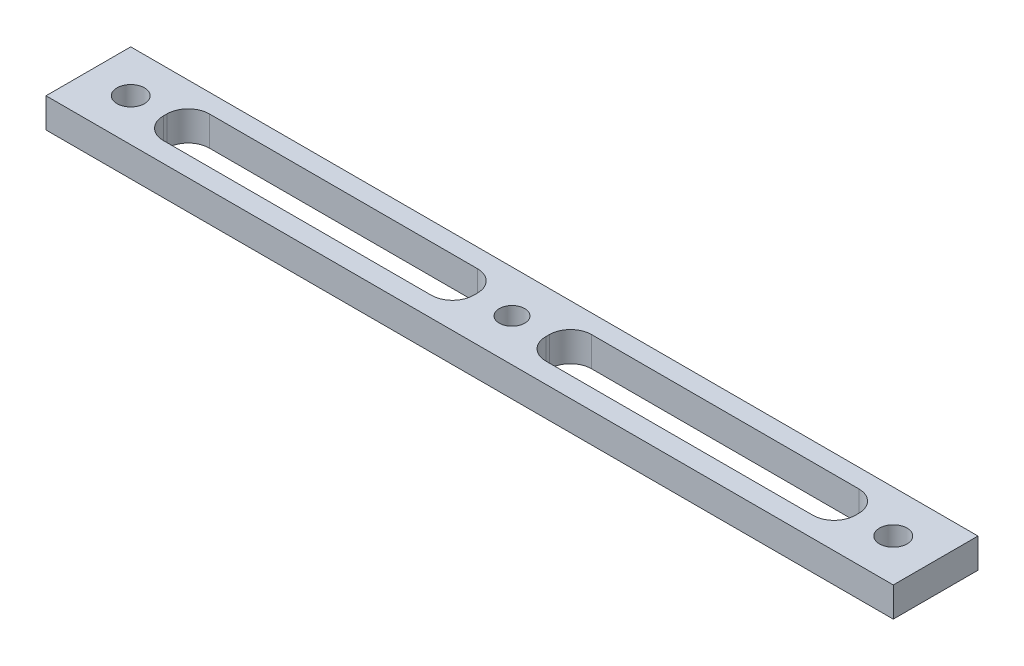
from build123d import *

# Parameters (mm, degrees)
SZKIC1_W                    = 200
SZKIC1_H                    = 20
SZKIC1_R                    = 3
SZKIC1_R_2                  = 3.25
DODANIE_WYCI_GNI_CIE1_DEPTH = 7


with BuildPart() as part:
    # Szkic1 → Dodanie-wyciągnięcie1 (new body)
    with BuildSketch(Plane(origin=(0, 0, 0), x_dir=(1, 0, 0), z_dir=(0, 1, 0))):
        with Locations((100, 10)):
            Rectangle(SZKIC1_W, SZKIC1_H)
        with Locations(Location((100, 10, 0), (0, 0, 270))):
            Circle(SZKIC1_R, mode=Mode.SUBTRACT)
        with Locations(Location((10, 10, 0), (0, 0, 270))):
            Circle(SZKIC1_R_2, mode=Mode.SUBTRACT)
        with Locations(Location((190, 10, 0), (0, 0, 270))):
            Circle(SZKIC1_R_2, mode=Mode.SUBTRACT)
        with BuildLine():
            Line((22.984822323, 15.57457628), (86.25939238, 15.57457628))
            ThreePointArc((86.25939238, 15.57457628), (89.794926286, 14.110110186), (91.25939238, 10.57457628))
            Line((91.25939238, 10.57457628), (91.25939238, 9.696719379))
            ThreePointArc((91.25939238, 9.696719379), (89.794926286, 6.161185473), (86.25939238, 4.696719379))
            Line((86.25939238, 4.696719379), (22.984822323, 4.696719379))
            ThreePointArc((22.984822323, 4.696719379), (19.449288417, 6.161185473), (17.984822323, 9.696719379))
            Line((17.984822323, 9.696719379), (17.984822323, 10.57457628))
            ThreePointArc((17.984822323, 10.57457628), (19.449288417, 14.110110186), (22.984822323, 15.57457628))
        make_face(mode=Mode.SUBTRACT)
        with BuildLine():
            Line((113.225148066, 15.57457628), (176.286209663, 15.57457628))
            ThreePointArc((176.286209663, 15.57457628), (179.821743569, 14.110110186), (181.286209663, 10.57457628))
            Line((181.286209663, 10.57457628), (181.286209663, 9.752776346))
            ThreePointArc((181.286209663, 9.752776346), (179.821743569, 6.21724244), (176.286209663, 4.752776346))
            Line((176.286209663, 4.752776346), (113.225148066, 4.752776346))
            ThreePointArc((113.225148066, 4.752776346), (109.68961416, 6.21724244), (108.225148066, 9.752776346))
            Line((108.225148066, 9.752776346), (108.225148066, 10.57457628))
            ThreePointArc((108.225148066, 10.57457628), (109.68961416, 14.110110186), (113.225148066, 15.57457628))
        make_face(mode=Mode.SUBTRACT)
    extrude(amount=DODANIE_WYCI_GNI_CIE1_DEPTH)


solid = part.part
